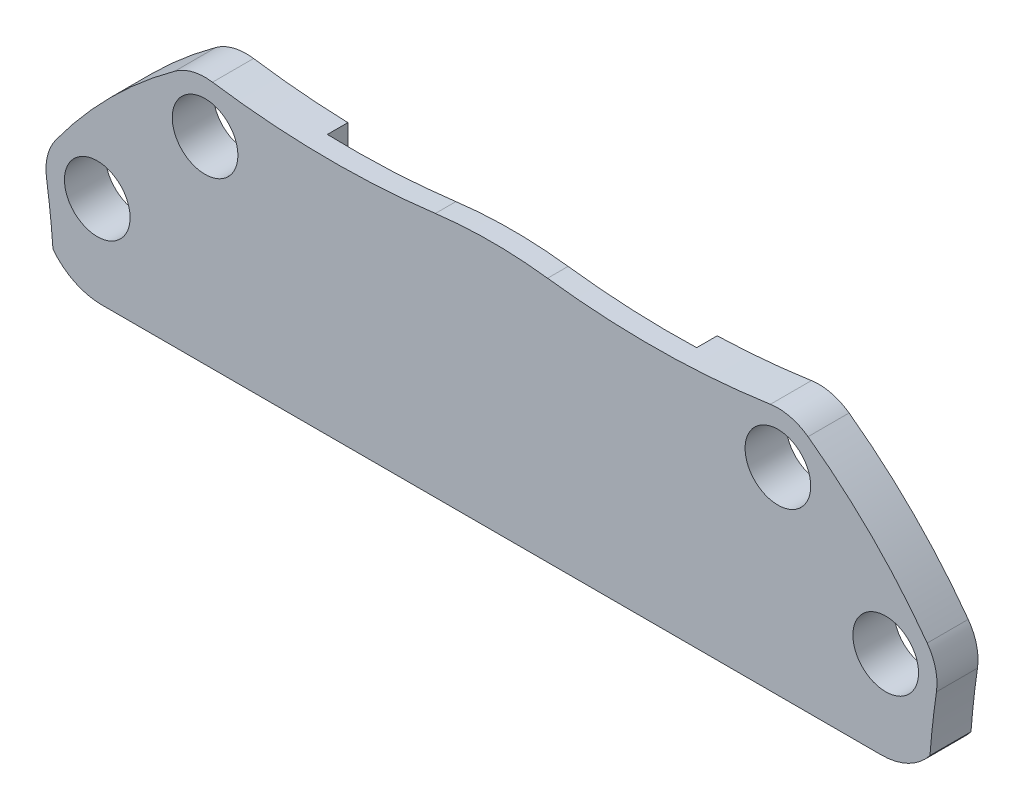
from build123d import *

# Parameters (mm, degrees)
SKETCH_1_R          = 1.6
EXTRUDE_1_DEPTH     = 2
SKETCH_2_W          = 18
SKETCH_2_H          = 1
CUT_EXTRUDE_1_DEPTH = 27.153393661
CUT_EXTRUDE_2_DEPTH = 33.316370891


with BuildPart() as part:
    # 草图1 → 凸台-拉伸1 (new body)
    with BuildSketch(Plane.XY):
        with BuildLine():
            Line((-19, 23.587026679), (19, 23.587026679))
            ThreePointArc((19, 23.587026679), (21.121320344, 22.708347023), (22, 20.587026679))
            Line((22, 20.587026679), (22, 12.587026679))
            ThreePointArc((22, 12.587026679), (21.121320344, 10.465706336), (19, 9.587026679))
            Line((19, 9.587026679), (-19, 9.587026679))
            ThreePointArc((-19, 9.587026679), (-21.121320344, 10.465706336), (-22, 12.587026679))
            Line((-22, 12.587026679), (-22, 20.587026679))
            ThreePointArc((-22, 20.587026679), (-21.121320344, 22.708347023), (-19, 23.587026679))
        make_face()
        with Locations((19.214153616, 13.959899742)):
            Circle(SKETCH_1_R, mode=Mode.SUBTRACT)
        with Locations((13.959899742, 19.214153616)):
            Circle(SKETCH_1_R, mode=Mode.SUBTRACT)
        with Locations((-13.959899742, 19.214153616)):
            Circle(SKETCH_1_R, mode=Mode.SUBTRACT)
        with Locations((-19.214153616, 13.959899742)):
            Circle(SKETCH_1_R, mode=Mode.SUBTRACT)
    extrude(amount=EXTRUDE_1_DEPTH)

    # 草图2 → 切除-拉伸1 (cut, through all)
    with BuildSketch(Plane.XZ.offset(-9.587026679)):
        with Locations((0, 0.5)):
            Rectangle(SKETCH_2_W, SKETCH_2_H)
    extrude(amount=-CUT_EXTRUDE_1_DEPTH, mode=Mode.SUBTRACT)

    # 草图3 → 切除-拉伸2 (cut, through all)
    with BuildSketch(Plane.XY.offset(2)):
        with BuildLine():
            Line((22, 12.587026679), (22, 20.587026679))
            ThreePointArc((22, 20.587026679), (21.121320344, 22.708347023), (19, 23.587026679))
            Line((19, 23.587026679), (-19, 23.587026679))
            ThreePointArc((-19, 23.587026679), (-21.121320344, 22.708347023), (-22, 20.587026679))
            Line((-22, 20.587026679), (-22, 12.587026679))
            ThreePointArc((-22, 12.587026679), (-21.838569798, 11.616191212), (-21.371652331, 10.749837189))
            ThreePointArc((-21.371652331, 10.749837189), (-21.504078669, 12.175448442), (-21.687439927, 13.595407183))
            ThreePointArc((-21.687439927, 13.595407183), (-21.641903091, 14.556584324), (-21.236696102, 15.429362873))
            ThreePointArc((-21.236696102, 15.429362873), (-18.561553006, 18.561553006), (-15.429362873, 21.236696102))
            ThreePointArc((-15.429362873, 21.236696102), (-14.556584324, 21.641903091), (-13.595407183, 21.687439927))
            ThreePointArc((-13.595407183, 21.687439927), (-8.168716079, 21.262073185), (-2.734521388, 21.577416267))
            ThreePointArc((-2.734521388, 21.577416267), (0, 21.75), (2.734521388, 21.577416267))
            ThreePointArc((2.734521388, 21.577416267), (8.168716079, 21.262073185), (13.595407183, 21.687439927))
            ThreePointArc((13.595407183, 21.687439927), (14.556584324, 21.641903091), (15.429362873, 21.236696102))
            ThreePointArc((15.429362873, 21.236696102), (18.561553006, 18.561553006), (21.236696102, 15.429362873))
            ThreePointArc((21.236696102, 15.429362873), (21.641903091, 14.556584324), (21.687439927, 13.595407183))
            ThreePointArc((21.687439927, 13.595407183), (21.504078669, 12.175448442), (21.371652331, 10.749837189))
            ThreePointArc((21.371652331, 10.749837189), (21.838569798, 11.616191212), (22, 12.587026679))
        make_face()
    extrude(amount=-CUT_EXTRUDE_2_DEPTH, mode=Mode.SUBTRACT)


solid = part.part
